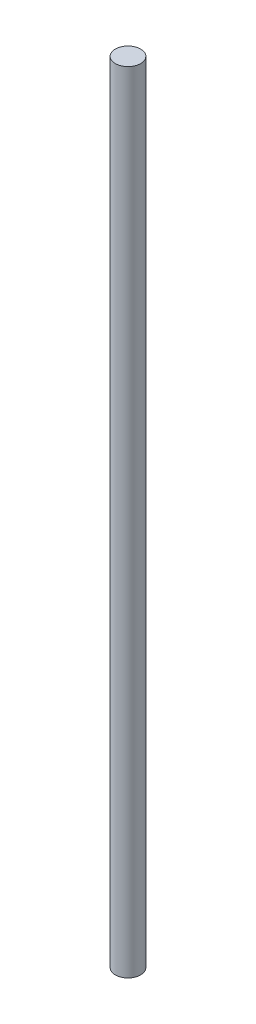
from build123d import *

# Parameters (mm, degrees)
SKETCH1_R           = 4
BOSS_EXTRUDE1_DEPTH = 125


with BuildPart() as part:
    # Sketch1 → Boss-Extrude1 (new, symmetric)
    with BuildSketch(Plane(origin=(0, 0, 0), x_dir=(1, 0, 0), z_dir=(0, 1, 0))):
        with Locations(Location((0, 0, 0), (0, 0, 270))):
            Circle(SKETCH1_R)
    extrude(amount=BOSS_EXTRUDE1_DEPTH, both=True)


solid = part.part
